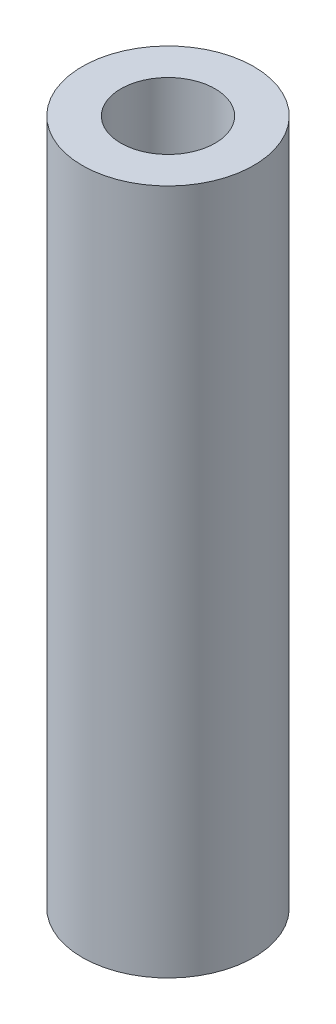
from build123d import *

# Parameters (mm, degrees)
SKIZZE1_R                       = 5
SKIZZE1_R_2                     = 2.75
AUFSATZ_LINEAR_AUSTRAGEN1_DEPTH = 40


with BuildPart() as part:
    # Skizze1 → Aufsatz-Linear austragen1 (new body)
    with BuildSketch(Plane(origin=(0, 0, 0), x_dir=(1, 0, 0), z_dir=(0, 1, 0))):
        with Locations(Location((0, 0, 0), (0, 0, 270))):
            Circle(SKIZZE1_R)
        with Locations(Location((0, 0, 0), (0, 0, 270))):
            Circle(SKIZZE1_R_2, mode=Mode.SUBTRACT)
    extrude(amount=AUFSATZ_LINEAR_AUSTRAGEN1_DEPTH)


solid = part.part
